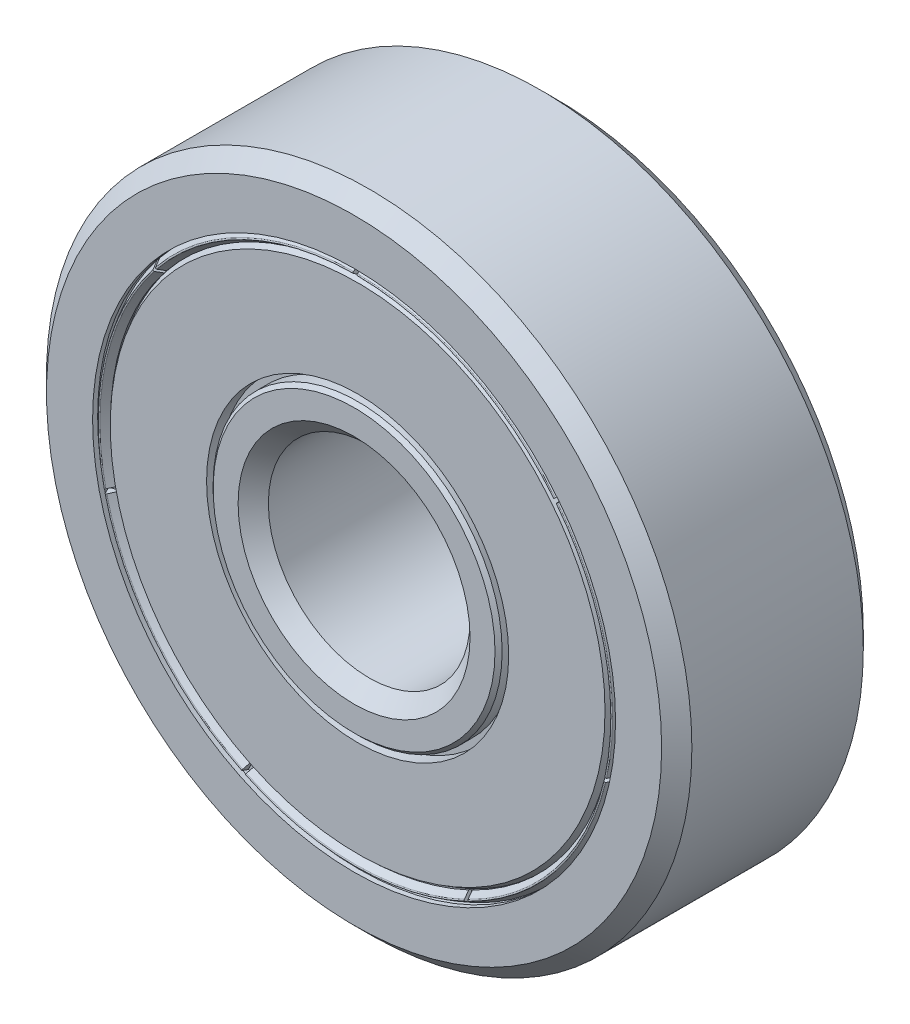
from build123d import *

# Parameters (mm, degrees)
CIRPATTERN1_COUNT  = 7
FILLET1_R          = 0.025
CUT_EXTRUDE1_START = 2.259293
CUT_EXTRUDE1_DEPTH = 10.327337226
CIRPATTERN2_COUNT  = 7


with BuildPart() as part:
    # Sketch3 → Revolve1 (revolve)
    with BuildSketch(Plane(origin=(0, 0, 0), x_dir=(0, 0, -1), z_dir=(1, 0, 0)), mode=Mode.PRIVATE) as revolve1_sk:
        with BuildLine():
            Line((2.125, 8), (-2.125, 8))
            Line((-2.125, 8), (-2.5, 7.625))
            Line((-2.5, 7.625), (-2.5, 6.482421109))
            Line((-2.5, 6.482421109), (-2.375, 6.482421109))
            Line((-2.375, 6.482421109), (-2.375, 6.828710555))
            Line((-2.375, 6.828710555), (-2.286611652, 6.917098902))
            Line((-2.286611652, 6.917098902), (-0.9625, 6.917098902))
            ThreePointArc((-0.9625, 6.917098902), (0, 7.175), (0.9625, 6.917098902))
            Line((0.9625, 6.917098902), (2.286611652, 6.917098902))
            Line((2.286611652, 6.917098902), (2.375, 6.828710555))
            Line((2.375, 6.828710555), (2.375, 6.482421109))
            Line((2.375, 6.482421109), (2.5, 6.482421109))
            Line((2.5, 6.482421109), (2.5, 7.625))
            Line((2.5, 7.625), (2.125, 8))
        make_face()
        with BuildLine():
            Line((2.125, 2.5), (-2.125, 2.5))
            Line((-2.125, 2.5), (-2.5, 2.875))
            Line((-2.5, 2.875), (-2.5, 3.49451275))
            Line((-2.5, 3.49451275), (-2.411611652, 3.582901098))
            Line((-2.411611652, 3.582901098), (-0.9625, 3.582901098))
            ThreePointArc((-0.9625, 3.582901098), (0, 3.325), (0.9625, 3.582901098))
            Line((0.9625, 3.582901098), (2.411611652, 3.582901098))
            Line((2.411611652, 3.582901098), (2.5, 3.49451275))
            Line((2.5, 3.49451275), (2.5, 2.875))
            Line((2.5, 2.875), (2.125, 2.5))
        make_face()
    revolve(revolve1_sk.sketch.rotate(Axis((0, 0, 2.5), (0, 0, -1)), 90), axis=Axis((0, 0, 2.5), (0, 0, -1)))


with BuildPart() as body_2:
    # Sketch4 → Revolve2 (revolve)
    with BuildSketch(Plane(origin=(0, 0, 0), x_dir=(0, 0, -1), z_dir=(1, 0, 0))):
        with BuildLine():
            Line((0, 7.175), (0, 3.325))
            ThreePointArc((0, 3.325), (-1.925, 5.25), (0, 7.175))
        make_face()
    revolve(axis=Axis((0, 8, 0), (0, -1, 0)))


with BuildPart() as cirpattern1_1:
    # CirPattern1: pattern copy
    add(body_2.part.rotate(Axis((0, 0, 0), (0, 0, 1)), 1 * 360 / CIRPATTERN1_COUNT))


with BuildPart() as cirpattern1_2:
    # CirPattern1: pattern copy
    add(body_2.part.rotate(Axis((0, 0, 0), (0, 0, 1)), 2 * 360 / CIRPATTERN1_COUNT))


with BuildPart() as cirpattern1_3:
    # CirPattern1: pattern copy
    add(body_2.part.rotate(Axis((0, 0, 0), (0, 0, 1)), 3 * 360 / CIRPATTERN1_COUNT))


with BuildPart() as cirpattern1_4:
    # CirPattern1: pattern copy
    add(body_2.part.rotate(Axis((0, 0, 0), (0, 0, 1)), 4 * 360 / CIRPATTERN1_COUNT))


with BuildPart() as cirpattern1_5:
    # CirPattern1: pattern copy
    add(body_2.part.rotate(Axis((0, 0, 0), (0, 0, 1)), 5 * 360 / CIRPATTERN1_COUNT))


with BuildPart() as cirpattern1_6:
    # CirPattern1: pattern copy
    add(body_2.part.rotate(Axis((0, 0, 0), (0, 0, 1)), 6 * 360 / CIRPATTERN1_COUNT))


with BuildPart() as body_9:
    # Sketch5 → Revolve3 (revolve)
    with BuildSketch(Plane(origin=(0, 0, 0), x_dir=(0, 0, -1), z_dir=(1, 0, 0)), mode=Mode.PRIVATE) as revolve3_sk:
        Polygon((-1.925, 3.582901098), (-2.087203884, 3.582901098), (-2.087203884, 3.745104982), (-2.411611652, 3.745104982), (-2.411611652, 6.132920313), (-2.087203884, 6.320217225), (-1.925, 6.320217225), align=None)
        Polygon((2.087203884, 6.320217225), (1.925, 6.320217225), (1.925, 3.582901098), (2.087203884, 3.582901098), (2.087203884, 3.745104982), (2.411611652, 3.745104982), (2.411611652, 6.132920313), align=None)
    revolve(revolve3_sk.sketch.rotate(Axis((0, 0, 2.5), (0, 0, -1)), 90), axis=Axis((0, 0, 2.5), (0, 0, -1)))


with BuildPart() as body_10:
    # Sketch6 → Revolve4 (revolve)
    with BuildSketch(Plane(origin=(0, 0, 0), x_dir=(0, 0, -1), z_dir=(1, 0, 0)), mode=Mode.PRIVATE) as revolve4_sk:
        Polygon((-2.237336053, 6.482421109), (-2.28125, 6.482421109), (-2.5, 6.356125738), (-2.312336053, 6.224722028), (-2.287336053, 6.224722028), (-2.237336053, 6.233538377), align=None)
    revolve(revolve4_sk.sketch.rotate(Axis((0, 0, 2.5), (0, 0, -1)), 90), axis=Axis((0, 0, 2.5), (0, 0, -1)))

    # Fillet1
    fillet1_edges = [body_10.edges().sort_by_distance(p)[0] for p in [
        (-6.356125738, 0, 2.5),
    ]]
    fillet(fillet1_edges, radius=FILLET1_R)

    # Sketch7 → Cut-Extrude1 (cut, through all)
    with BuildSketch(Plane.XY.offset(CUT_EXTRUDE1_START)):
        Polygon((-0.05, 6.482421109), (-0.05, 6.582421109), (0.05, 6.582421109), (0.05, 6.482421109), (0.05, 6.224722028), (0.05, 6.124722028), (-0.05, 6.124722028), (-0.05, 6.224722028), align=None)
    cut_extrude1 = extrude(amount=CUT_EXTRUDE1_DEPTH, mode=Mode.SUBTRACT)

    # CirPattern2: Cut-Extrude1 ×7 about axis
    cirpattern2_axis = Axis((0, 0, 0), (0, 0, 1))
    for i in range(1, CIRPATTERN2_COUNT):
        add(cut_extrude1.rotate(cirpattern2_axis, i * 360 / CIRPATTERN2_COUNT), mode=Mode.SUBTRACT)


with BuildPart() as body_11:
    # Mirror1: mirrored copy
    add(body_10.part.mirror(Plane.XY))


solid = Compound([part.part, body_2.part, cirpattern1_1.part, cirpattern1_2.part, cirpattern1_3.part, cirpattern1_4.part, cirpattern1_5.part, cirpattern1_6.part, body_9.part, body_10.part, body_11.part])
